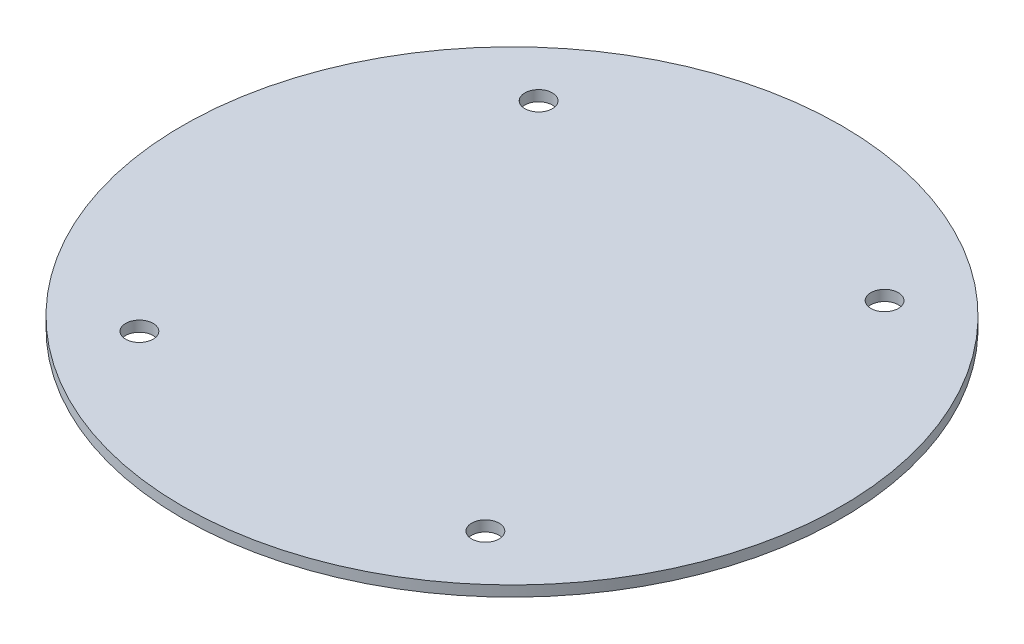
from build123d import *

# Parameters (mm, degrees)
SKETCH1_R               = 49.53
EXTRUDE1_DEPTH          = 1.5875
SKETCH2_R               = 2.06375
EXTRUDE2_DEPTH          = 10
MIRROR3_COPY_1_SKETCH_R = 2.06375
MIRROR3_COPY_1_DEPTH    = 10


with BuildPart() as part:
    # Sketch1 → Extrude1 (new body)
    with BuildSketch(Plane(origin=(0, 0, 0), x_dir=(1, 0, 0), z_dir=(0, 1, 0))):
        with Locations(Location((0, 0, 0), (0, 0, 270))):
            Circle(SKETCH1_R)
    extrude(amount=EXTRUDE1_DEPTH)

    # Sketch2 → Extrude2 (cut)
    with BuildSketch(Plane(origin=(0, 1.5875, 0), x_dir=(-1, 0, 0), z_dir=(0, 1, 0))):
        with Locations(Location((-26, -30, 0), (0, 0, 90))):
            Circle(SKETCH2_R)
    extrude2 = extrude(amount=-EXTRUDE2_DEPTH, mode=Mode.SUBTRACT)

    # Mirror1: Extrude2 across plane
    add(extrude2.mirror(Plane(origin=(0, 0, 0), x_dir=(0, 0, 1), z_dir=(1, 0, 0))), mode=Mode.SUBTRACT)

    # Mirror3: Extrude2 across plane
    add(extrude2.mirror(Plane.XY), mode=Mode.SUBTRACT)

    # Mirror3 copy 1 sketch → Mirror3 copy 1 (cut)
    with BuildSketch(Plane(origin=(0, 1.5875, 0), x_dir=(1, 0, 0), z_dir=(0, 1, 0))):
        with Locations(Location((-26, -30, 0), (0, 0, 90))):
            Circle(MIRROR3_COPY_1_SKETCH_R)
    extrude(amount=-MIRROR3_COPY_1_DEPTH, mode=Mode.SUBTRACT)


solid = part.part
